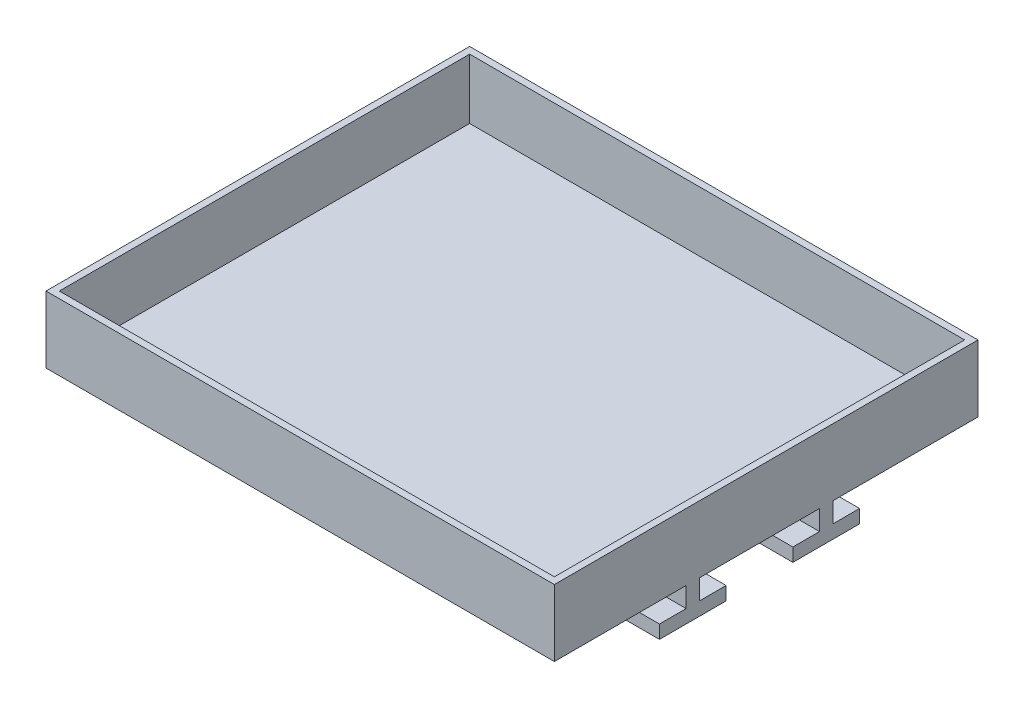
from build123d import *

# Parameters (mm, degrees)
SKETCH1_W           = 76.2
SKETCH1_H           = 63.5
BOSS_EXTRUDE1_DEPTH = 10
SHELL1_T            = -1
BOSS_EXTRUDE2_DEPTH = 76.2
LPATTERN1_COUNT     = 2
LPATTERN1_PITCH     = 20


with BuildPart() as part:
    # Sketch1 → Boss-Extrude1 (new body)
    with BuildSketch(Plane(origin=(0, 0, 0), x_dir=(1, 0, 0), z_dir=(0, 1, 0))):
        Rectangle(SKETCH1_W, SKETCH1_H)
    extrude(amount=BOSS_EXTRUDE1_DEPTH)

    # Shell1
    shell1_openings = [part.faces().sort_by_distance(p)[0] for p in [
        (0, 10, 0),
    ]]
    offset(amount=SHELL1_T, openings=shell1_openings, kind=Kind.INTERSECTION)

    # Sketch2 → Boss-Extrude2 (add)
    with BuildSketch(Plane(origin=(38.1, 0, 0), x_dir=(0, 0, -1), z_dir=(1, 0, 0))):
        Polygon((10, -3), (14, -3), (14, -5), (4, -5), (4, -3), (8, -3), (8, 0), (10, 0), align=None)
    boss_extrude2 = extrude(amount=-BOSS_EXTRUDE2_DEPTH)

    # LPattern1: Boss-Extrude2 ×2
    with Locations(*[(0, 0, i * LPATTERN1_PITCH) for i in range(1, LPATTERN1_COUNT)]):
        add(boss_extrude2)


solid = part.part
